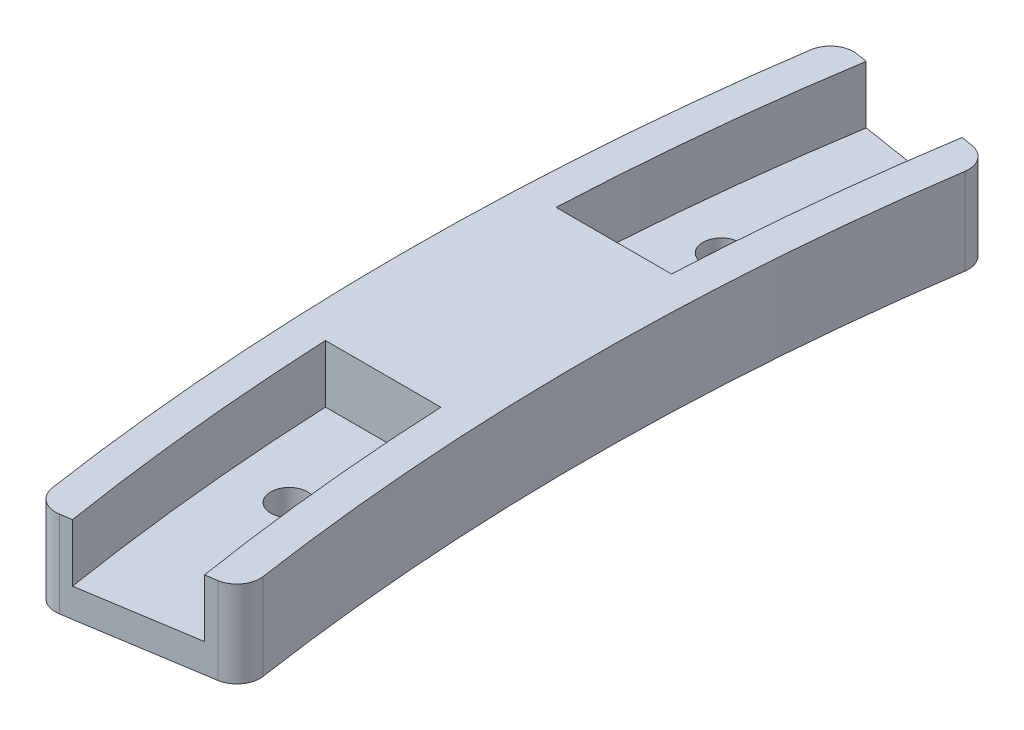
from build123d import *

# Parameters (mm, degrees)
BOSS_EXTRUDE1_DEPTH        = 10
CUT_EXTRUDE1_DEPTH         = 5
F_3_2_3_2_DIAMETER_HOLE1_D = 3.2
FILLET1_R                  = 2
CUT_EXTRUDE2_START         = -2.5
CUT_EXTRUDE2_DEPTH         = 2.5


with BuildPart() as part:
    # Sketch1 → Boss-Extrude1 (new body)
    with BuildSketch(Plane(origin=(0, 0, 0), x_dir=(1, 0, 0), z_dir=(0, 1, 0))):
        with BuildLine():
            ThreePointArc((-207.414551525, 32.851237658), (-210, 0), (-207.414551525, -32.851237658))
            Line((-207.414551525, -32.851237658), (-217.291434931, -34.415582309))
            ThreePointArc((-217.291434931, -34.415582309), (-220, 0), (-217.291434931, 34.415582309))
            Line((-217.291434931, 34.415582309), (-207.414551525, 32.851237658))
        make_face()
        with BuildLine():
            ThreePointArc((-217.291434931, -34.415582309), (-220, 0), (-217.291434931, 34.415582309))
            Line((-217.291434931, 34.415582309), (-220.254499953, 34.884885704))
            ThreePointArc((-220.254499953, 34.884885704), (-223, 0), (-220.254499953, -34.884885704))
            Line((-220.254499953, -34.884885704), (-217.291434931, -34.415582309))
        make_face()
        with BuildLine():
            Line((-204.451486503, 32.381934263), (-207.414551525, 32.851237658))
            ThreePointArc((-207.414551525, 32.851237658), (-210, 0), (-207.414551525, -32.851237658))
            Line((-207.414551525, -32.851237658), (-204.451486503, -32.381934263))
            ThreePointArc((-204.451486503, -32.381934263), (-207, 0), (-204.451486503, 32.381934263))
        make_face()
    extrude(amount=BOSS_EXTRUDE1_DEPTH)

    # Sketch15 → Cut-Extrude1 (cut)
    with BuildSketch(Plane(origin=(0, 10, 0), x_dir=(1, 0, 0), z_dir=(0, 1, 0))):
        with BuildLine():
            Line((-219.772609758, 10), (-209.761769634, 10))
            ThreePointArc((-209.761769634, 10), (-208.900850883, 21.457737542), (-207.414551525, 32.851237658))
            Line((-207.414551525, 32.851237658), (-217.291434931, 34.415582309))
            ThreePointArc((-217.291434931, 34.415582309), (-218.872736893, 22.242415451), (-219.772609758, 10))
        make_face()
        with BuildLine():
            ThreePointArc((-207.414551525, -32.851237658), (-208.900850883, -21.457737542), (-209.761769634, -10))
            Line((-209.761769634, -10), (-219.772609758, -10))
            ThreePointArc((-219.772609758, -10), (-218.872736893, -22.242415451), (-217.291434931, -34.415582309))
            Line((-217.291434931, -34.415582309), (-207.414551525, -32.851237658))
        make_face()
    extrude(amount=-CUT_EXTRUDE1_DEPTH, mode=Mode.SUBTRACT)

    # Ø3.2 (3.2) Diameter Hole1 (through all)
    with Locations(Plane(origin=(0, 0, 0), x_dir=(-1, 0, 0), z_dir=(0, -1, 0))):
        with Locations((214.18186009, -18.738484691), (214.18186009, 18.738484691)):
            Hole(F_3_2_3_2_DIAMETER_HOLE1_D / 2)

    # Fillet1
    fillet1_edges = [part.edges().sort_by_distance(p)[0] for p in [
        (-220.254499953, 5, 34.884885704),
        (-220.254499953, 5, -34.884885704),
        (-204.451486503, 5, -32.381934263),
        (-204.451486503, 5, 32.381934263),
    ]]
    fillet(fillet1_edges, radius=FILLET1_R)

    # Sketch19 → Cut-Extrude2 (cut)
    with BuildSketch(Plane.XZ.offset(CUT_EXTRUDE2_START)):
        with BuildLine():
            Line((-218.270184732, -34.570601048), (-206.417411405, -32.693306179))
            ThreePointArc((-206.417411405, -32.693306179), (-205.117889671, -31.901228423), (-204.75200014, -30.423978019))
            ThreePointArc((-204.75200014, -30.423978019), (-207, 0), (-204.75200014, 30.423978019))
            ThreePointArc((-204.75200014, 30.423978019), (-205.117889671, 31.901228423), (-206.417411405, 32.693306179))
            Line((-206.417411405, 32.693306179), (-218.270184732, 34.570601048))
            ThreePointArc((-218.270184732, 34.570601048), (-219.765933628, 34.207922413), (-220.561180845, 32.890203773))
            ThreePointArc((-220.561180845, 32.890203773), (-223, 0), (-220.561180845, -32.890203773))
            ThreePointArc((-220.561180845, -32.890203773), (-219.765933628, -34.207922413), (-218.270184732, -34.570601048))
        make_face()
    extrude(amount=CUT_EXTRUDE2_DEPTH, mode=Mode.SUBTRACT)


solid = part.part
